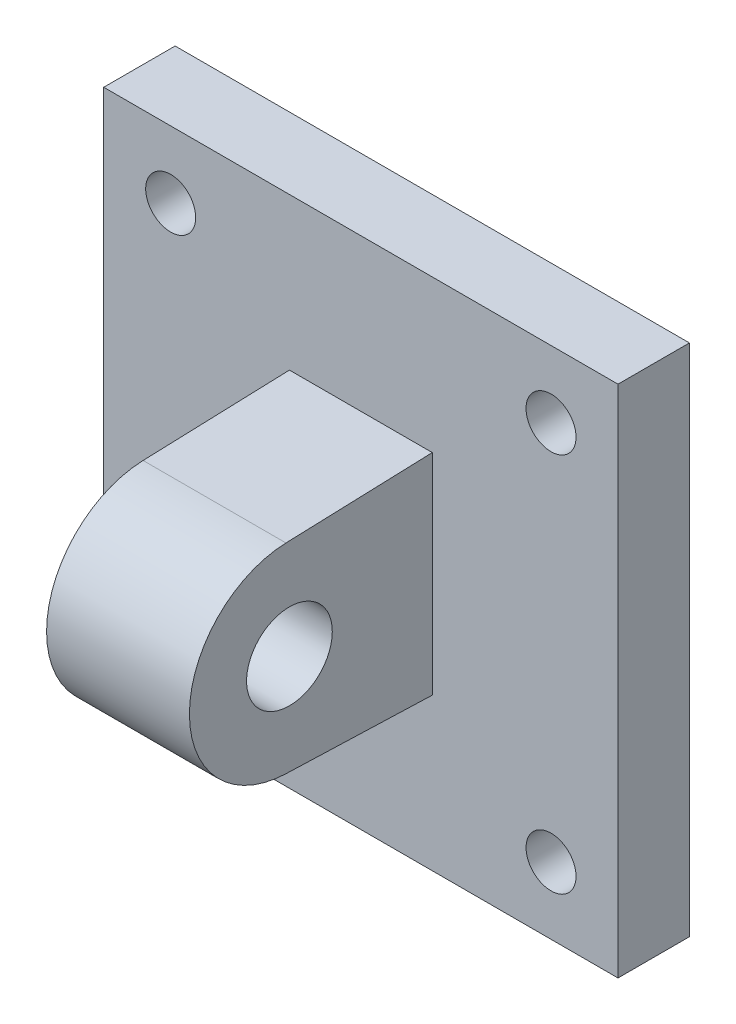
from build123d import *

# Parameters (mm, degrees)
SKETCH3_W                = 114.3
SKETCH3_H                = 114.3
SKETCH3_R                = 5.55625
BOSS_EXTRUDE1_DEPTH      = 15.875
BOSS_EXTRUDE2_DEPTH      = 15.875
BOSS_EXTRUDE2_DEPTH_BACK = 15.875
SKETCH4_R                = 9.525


with BuildPart() as part:
    # Sketch3 → Boss-Extrude1 (new body)
    with BuildSketch(Plane.XY):
        Rectangle(SKETCH3_W, SKETCH3_H)
        with Locations((-42.2671875, -42.2671875)):
            Circle(SKETCH3_R, mode=Mode.SUBTRACT)
        with Locations((42.2671875, -42.2671875)):
            Circle(SKETCH3_R, mode=Mode.SUBTRACT)
        with Locations((42.2671875, 42.2671875)):
            Circle(SKETCH3_R, mode=Mode.SUBTRACT)
        with Locations((-42.2671875, 42.2671875)):
            Circle(SKETCH3_R, mode=Mode.SUBTRACT)
    extrude(amount=BOSS_EXTRUDE1_DEPTH)

    # Sketch4 → Boss-Extrude2 (add, two sides: drawn at the far end of the back side and taken through both)
    with BuildSketch(Plane(origin=(0, 0, 0), x_dir=(0, 0, -1), z_dir=(1, 0, 0)).offset(-BOSS_EXTRUDE2_DEPTH_BACK)):
        with BuildLine():
            Line((-48.400641314, 22.21146113), (-15.875, 23.347281553))
            Line((-15.875, 23.347281553), (-15.875, -23.347281553))
            Line((-15.875, -23.347281553), (-48.400641314, -22.21146113))
            ThreePointArc((-48.400641314, -22.21146113), (-69.85, 0), (-48.400641314, 22.21146113))
        make_face()
        with Locations((-47.625, 0)):
            Circle(SKETCH4_R, mode=Mode.SUBTRACT)
    extrude(amount=BOSS_EXTRUDE2_DEPTH + BOSS_EXTRUDE2_DEPTH_BACK)


solid = part.part
